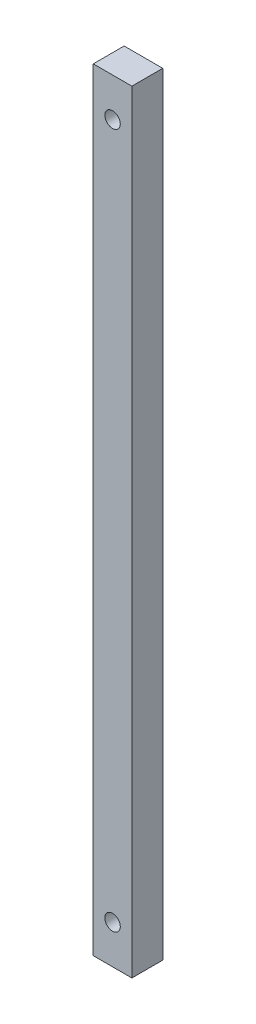
from build123d import *

# Parameters (mm, degrees)
SKETCH_1_W          = 5
SKETCH_1_H          = 4
EXTRUDE_1_DEPTH     = 100
SKETCH_2_R          = 1
CUT_EXTRUDE_1_DEPTH = 10


with BuildPart() as part:
    # 草图1 → 凸台-拉伸1 (new body)
    with BuildSketch(Plane(origin=(0, 0, 0), x_dir=(1, 0, 0), z_dir=(0, 1, 0))):
        Rectangle(SKETCH_1_W, SKETCH_1_H)
    extrude(amount=EXTRUDE_1_DEPTH)

    # 草图2 → 切除-拉伸1 (cut)
    with BuildSketch(Plane(origin=(0, 0, -2), x_dir=(-1, 0, 0), z_dir=(0, 0, -1))):
        with Locations((0, 5)):
            Circle(SKETCH_2_R)
        with Locations((0, 95)):
            Circle(SKETCH_2_R)
    extrude(amount=-CUT_EXTRUDE_1_DEPTH, mode=Mode.SUBTRACT)


solid = part.part
